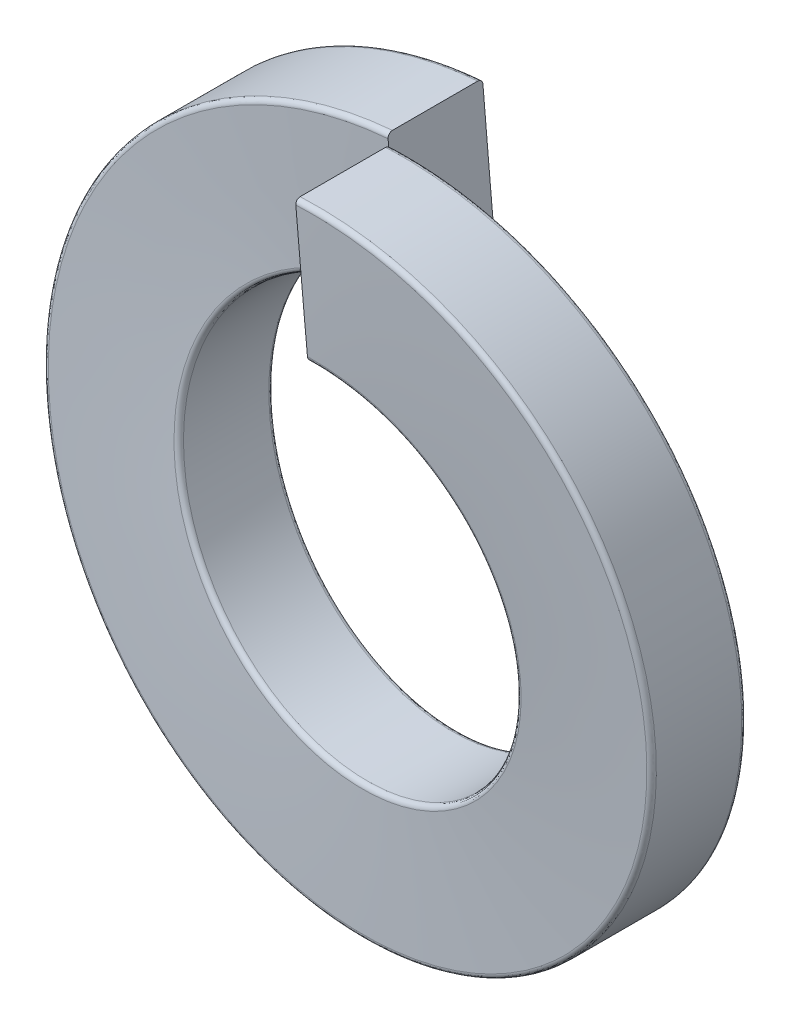
from build123d import *

# Parameters (mm, degrees)
SWEEP1_PITCH            = 3.4925
SWEEP1_HEIGHT           = 3.4925
SWEEP1_RADIUS           = 11.0363
SWEEP1_START_ANGLE      = 90
SKETCH4_W               = 3.175
SKETCH4_H               = 4.5339
FILLET1_R               = 0.15875
CUT_EXTRUDE1_DEPTH      = 16.993666972
CUT_EXTRUDE1_DEPTH_BACK = 16.993666972


with BuildPart() as part:
    # Sweep1: sweep along a helix
    with BuildLine() as sweep1_path:
        add(Helix(SWEEP1_PITCH, SWEEP1_HEIGHT, SWEEP1_RADIUS, center=(0, 0, -3.4925), direction=(0, 0, 1), mode=Mode.PRIVATE).rotate(Axis((0, 0, -3.4925), (0, 0, 1)), SWEEP1_START_ANGLE))
    # Sketch4 → Sweep1 (sweep)
    with BuildSketch(Plane(origin=(0, 0, 0), x_dir=(0, 0, -1), z_dir=(1, 0, 0))):
        with Locations((1.905, 8.76935)):
            Rectangle(SKETCH4_W, SKETCH4_H)
    sweep(path=sweep1_path.line, is_frenet=True)

    # Fillet1
    fillet1_edges = [part.edges().sort_by_distance(p)[0] for p in [
        (0, -11.036288119, 1.42875),
        (0, -6.502393, 1.42875),
        (0, -6.502393, -1.74625),
        (0, -11.036288119, -1.74625),
    ]]
    fillet(fillet1_edges, radius=FILLET1_R)

    # Sketch5 → Cut-Extrude1 (cut, two sides: drawn at the far end of the back side and taken through both)
    with BuildSketch(Plane.XY.offset(-CUT_EXTRUDE1_DEPTH_BACK)):
        with BuildLine():
            Line((0, 11.0363), (0.386712496, 6.490890479))
            Line((0.386712496, 6.490890479), (0.386712496, 0))
            Line((0.386712496, 0), (0, 0))
            Line((0, 0), (0, 6.5024))
            Line((0, 6.5024), (-0.385161315, 11.029576984))
            ThreePointArc((-0.385161315, 11.029576984), (-0.192609993, 11.034619118), (0, 11.0363))
        make_face()
    extrude(amount=CUT_EXTRUDE1_DEPTH + CUT_EXTRUDE1_DEPTH_BACK, mode=Mode.SUBTRACT)


solid = part.part
